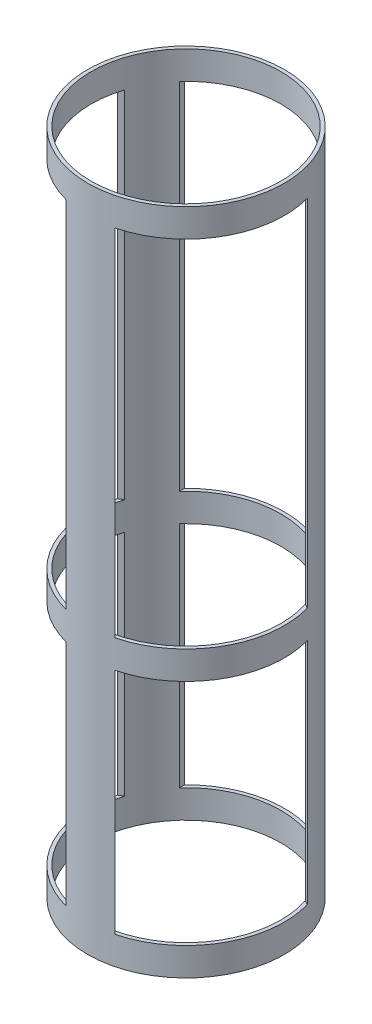
from build123d import *

# Parameters (mm, degrees)
SKETCH1_R               = 88.9
SKETCH1_R_2             = 85.725
BOSS_EXTRUDE1_DEPTH     = 301.625
CUT_EXTRUDE1_REACH      = 328.778
CUT_EXTRUDE1_END_RADIUS = 88.9
SKETCH2_W               = 127
SKETCH2_H               = 206.502
SKETCH2_H_2             = 320.548
CIRPATTERN1_COUNT       = 3


with BuildPart() as part:
    # Sketch1 → Boss-Extrude1 (new, symmetric)
    with BuildSketch(Plane(origin=(0, 0, 0), x_dir=(1, 0, 0), z_dir=(0, 1, 0))):
        with Locations(Location((0, 0, 0), (0, 0, 270))):
            Circle(SKETCH1_R)
        with Locations(Location((0, 0, 0), (0, 0, 270))):
            Circle(SKETCH1_R_2, mode=Mode.SUBTRACT)
    extrude(amount=BOSS_EXTRUDE1_DEPTH, both=True)

    # Cut-Extrude1: up to this cylinder (the profile starts inside it)
    cut_extrude1_end = Plane(origin=(0, -28.5115, 0), z_dir=(0, -1, 0)) * Cylinder(CUT_EXTRUDE1_END_RADIUS, 1125.281, mode=Mode.PRIVATE)
    # Sketch2 → Cut-Extrude1 (cut, up to the surface)
    with BuildSketch(Plane.XY, mode=Mode.PRIVATE) as cut_extrude1_sk1:
        with Locations((0, -172.974)):
            Rectangle(SKETCH2_W, SKETCH2_H)
    cut_extrude1_tool1 = extrude(cut_extrude1_sk1.sketch, amount=-CUT_EXTRUDE1_REACH, mode=Mode.PRIVATE) & cut_extrude1_end
    # Sketch2 → Cut-Extrude1 (cut, up to the surface)
    with BuildSketch(Plane.XY, mode=Mode.PRIVATE) as cut_extrude1_sk2:
        with Locations((0, 115.951)):
            Rectangle(SKETCH2_W, SKETCH2_H_2)
    cut_extrude1_tool2 = extrude(cut_extrude1_sk2.sketch, amount=-CUT_EXTRUDE1_REACH, mode=Mode.PRIVATE) & cut_extrude1_end
    cut_extrude1 = cut_extrude1_tool1.solids().sort_by_distance((0, -172.974, 0))[0] + cut_extrude1_tool2.solids().sort_by_distance((0, 115.951, 0))[0]
    add(cut_extrude1, mode=Mode.SUBTRACT)

    # CirPattern1: Cut-Extrude1 ×3 about axis
    cirpattern1_axis = Axis((0, 0, 0), (0, 1, 0))
    for i in range(1, CIRPATTERN1_COUNT):
        add(cut_extrude1.rotate(cirpattern1_axis, i * 360 / CIRPATTERN1_COUNT), mode=Mode.SUBTRACT)


solid = part.part
